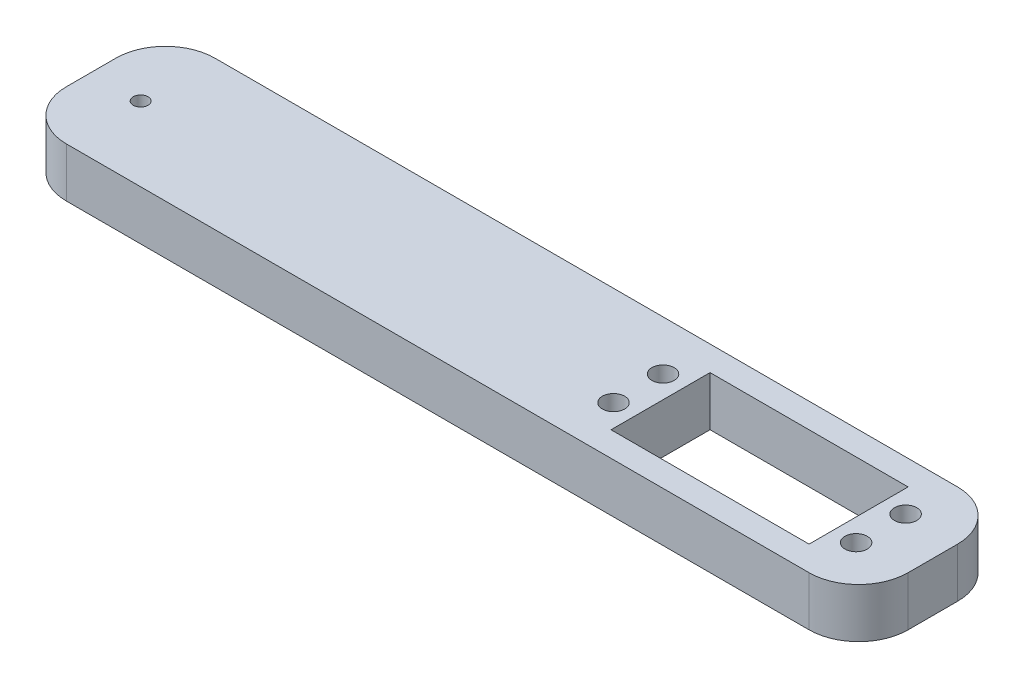
from build123d import *

# Parameters (mm, degrees)
CROQUIS1_W              = 170
CROQUIS1_H              = 30
CROQUIS1_W_2            = 40
CROQUIS1_H_2            = 20
SALIENTE_EXTRUIR1_DEPTH = 10
CROQUIS2_R              = 2.25
CORTAR_EXTRUIR1_DEPTH   = 10
REDONDEO3_R             = 10
CROQUIS3_R              = 1.5
CORTAR_EXTRUIR2_DEPTH   = 10


with BuildPart() as part:
    # Croquis1 → Saliente-Extruir1 (new body)
    with BuildSketch(Plane(origin=(0, 0, 0), x_dir=(1, 0, 0), z_dir=(0, 1, 0))):
        Rectangle(CROQUIS1_W, CROQUIS1_H)
        with Locations((50, 0)):
            Rectangle(CROQUIS1_W_2, CROQUIS1_H_2, mode=Mode.SUBTRACT)
    extrude(amount=SALIENTE_EXTRUIR1_DEPTH)

    # Croquis2 → Cortar-Extruir1 (cut)
    with BuildSketch(Plane(origin=(0, 10, 0), x_dir=(1, 0, 0), z_dir=(0, 1, 0))):
        with Locations(Location((74.5, -5, 0), (0, 0, 270))):
            Circle(CROQUIS2_R)
        with Locations(Location((74.5, 5, 0), (0, 0, 90))):
            Circle(CROQUIS2_R)
        with Locations(Location((25.5, -5, 0), (0, 0, 90))):
            Circle(CROQUIS2_R)
        with Locations(Location((25.5, 5, 0), (0, 0, 270))):
            Circle(CROQUIS2_R)
    extrude(amount=-CORTAR_EXTRUIR1_DEPTH, mode=Mode.SUBTRACT)

    # Redondeo3
    redondeo3_edges = [part.edges().sort_by_distance(p)[0] for p in [
        (-85, 5, -15),
        (85, 5, -15),
        (85, 5, 15),
        (-85, 5, 15),
    ]]
    fillet(redondeo3_edges, radius=REDONDEO3_R)

    # Croquis3 → Cortar-Extruir2 (cut)
    with BuildSketch(Plane(origin=(0, 10, 0), x_dir=(1, 0, 0), z_dir=(0, 1, 0))):
        with Locations(Location((-75, 0, 0), (0, 0, 270))):
            Circle(CROQUIS3_R)
    extrude(amount=-CORTAR_EXTRUIR2_DEPTH, mode=Mode.SUBTRACT)


solid = part.part
